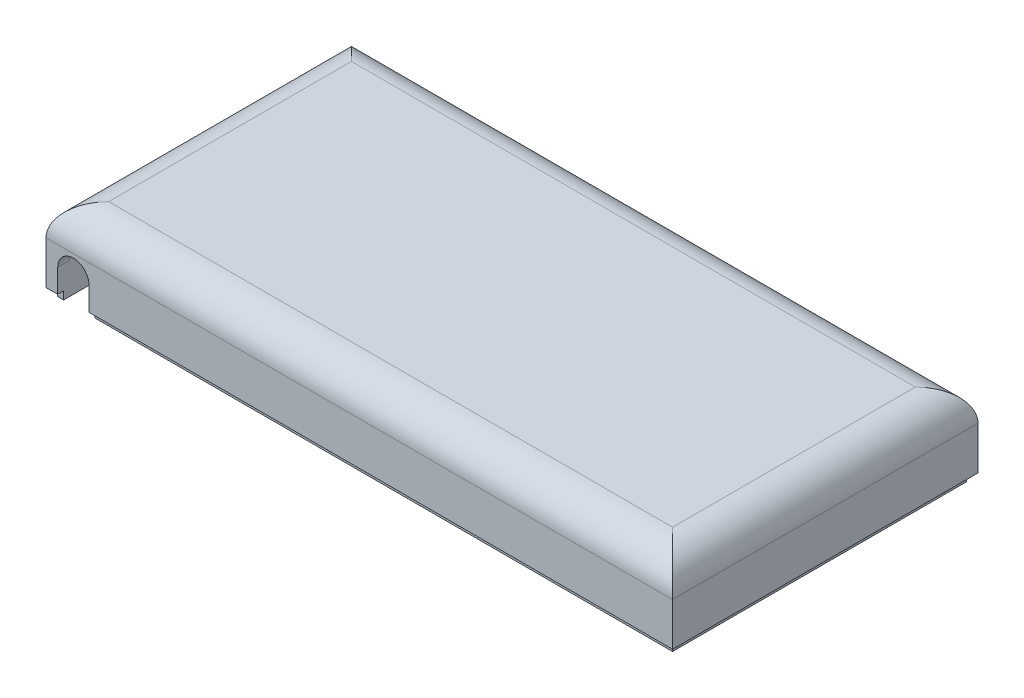
from build123d import *

# Parameters (mm, degrees)
SKETCH1_W           = 80
SKETCH1_H           = 39
SKETCH1_W_2         = 77
SKETCH1_H_2         = 36
BOSS_EXTRUDE1_DEPTH = 9
SKETCH2_W           = 80
SKETCH2_H           = 39
BOSS_EXTRUDE2_DEPTH = 1.5
SKETCH4_W           = 80
SKETCH4_H           = 39
SKETCH4_W_2         = 78.5
SKETCH4_H_2         = 37.5
CUT_EXTRUDE1_DEPTH  = 1
FILLET1_R           = 4
CUT_EXTRUDE2_REACH  = 58.844


with BuildPart() as part:
    # Sketch1 → Boss-Extrude1 (new body)
    with BuildSketch(Plane(origin=(0, 0, 0), x_dir=(1, 0, 0), z_dir=(0, 1, 0))):
        Rectangle(SKETCH1_W, SKETCH1_H)
        Rectangle(SKETCH1_W_2, SKETCH1_H_2, mode=Mode.SUBTRACT)
    extrude(amount=BOSS_EXTRUDE1_DEPTH)

    # Sketch2 → Boss-Extrude2 (add)
    with BuildSketch(Plane(origin=(0, 9, 0), x_dir=(1, 0, 0), z_dir=(0, 1, 0))):
        Rectangle(SKETCH2_W, SKETCH2_H)
    extrude(amount=BOSS_EXTRUDE2_DEPTH)

    # Sketch4 → Cut-Extrude1 (cut)
    with BuildSketch(Plane.XZ):
        Rectangle(SKETCH4_W, SKETCH4_H)
        Rectangle(SKETCH4_W_2, SKETCH4_H_2, mode=Mode.SUBTRACT)
    extrude(amount=-CUT_EXTRUDE1_DEPTH, mode=Mode.SUBTRACT)

    # Fillet1
    fillet1_edges = [part.edges().sort_by_distance(p)[0] for p in [
        (-40, 10.5, 0),
        (0, 10.5, 19.5),
        (40, 10.5, 0),
        (0, 10.5, -19.5),
    ]]
    fillet(fillet1_edges, radius=FILLET1_R)

    # Sketch5 → Cut-Extrude2 (cut, up to next)
    with BuildSketch(Plane.XY.offset(19.5), mode=Mode.PRIVATE) as cut_extrude2_sk1:
        with BuildLine():
            Line((-38.5, -2), (-38.5, 4))
            ThreePointArc((-38.5, 4), (-36.5, 6), (-34.5, 4))
            Line((-34.5, 4), (-34.5, -2))
            ThreePointArc((-34.5, -2), (-36.5, -4), (-38.5, -2))
        make_face()
    cut_extrude2_tool1 = extrude(cut_extrude2_sk1.sketch, amount=-CUT_EXTRUDE2_REACH, mode=Mode.PRIVATE) & part.part
    add(cut_extrude2_tool1.solids().sort_by_distance((-36.5, 1, 19.5))[0], mode=Mode.SUBTRACT)


solid = part.part
